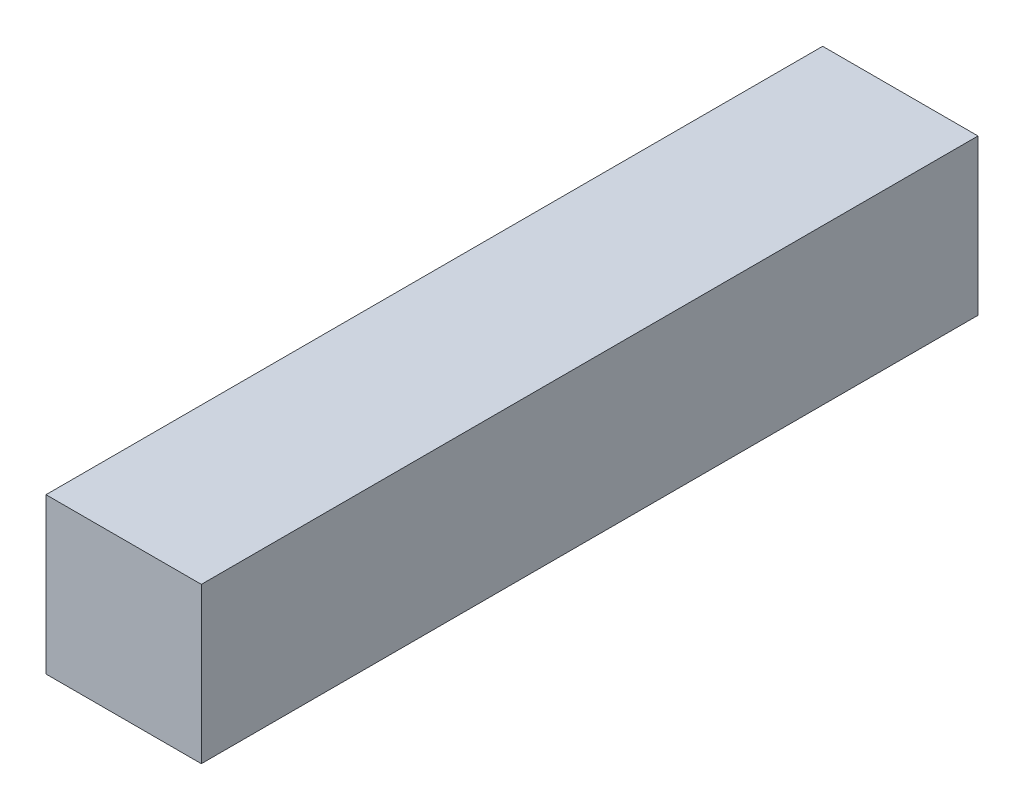
from build123d import *

# Parameters (mm, degrees)
SKETCH1_W           = 3
SKETCH1_H           = 3
BOSS_EXTRUDE1_DEPTH = 15


with BuildPart() as part:
    # Sketch1 → Boss-Extrude1 (new body)
    with BuildSketch(Plane.XY):
        Rectangle(SKETCH1_W, SKETCH1_H)
    extrude(amount=BOSS_EXTRUDE1_DEPTH)


solid = part.part
